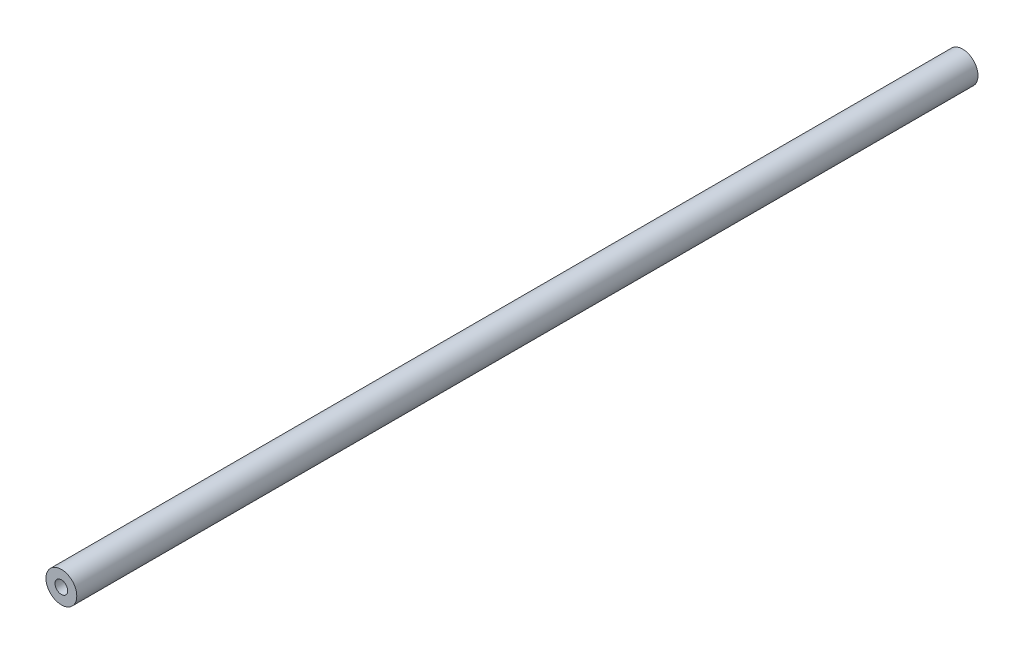
from build123d import *

# Parameters (mm, degrees)
SKETCH_1_R          = 4
EXTRUDE_1_DEPTH     = 234
SKETCH_2_R          = 1.65
CUT_EXTRUDE_1_DEPTH = 15
CUT_EXTRUDE_START   = -15
SKETCH_3_R          = 1.65
CUT_EXTRUDE_2_DEPTH = 15


with BuildPart() as part:
    # ｽｹｯﾁ1 → ﾎﾞｽ - 押し出し1 (new body)
    with BuildSketch(Plane.XY):
        Circle(SKETCH_1_R)
    extrude(amount=EXTRUDE_1_DEPTH)

    # ｽｹｯﾁ2 → ｶｯﾄ - 押し出し1 (cut)
    with BuildSketch(Plane.XY.offset(234)):
        Circle(SKETCH_2_R)
    extrude(amount=-CUT_EXTRUDE_1_DEPTH, mode=Mode.SUBTRACT)

    # ｽｹｯﾁ3 → ｶｯﾄ - 押し出し2 (cut)
    with BuildSketch(Plane(origin=(0, 0, 0), x_dir=(-1, 0, 0), z_dir=(0, 0, -1)).offset(CUT_EXTRUDE_START)):
        with Locations(Location((0, 0, 0), (0, 0, 180))):
            Circle(SKETCH_3_R)
    extrude(amount=CUT_EXTRUDE_2_DEPTH, mode=Mode.SUBTRACT)


solid = part.part
